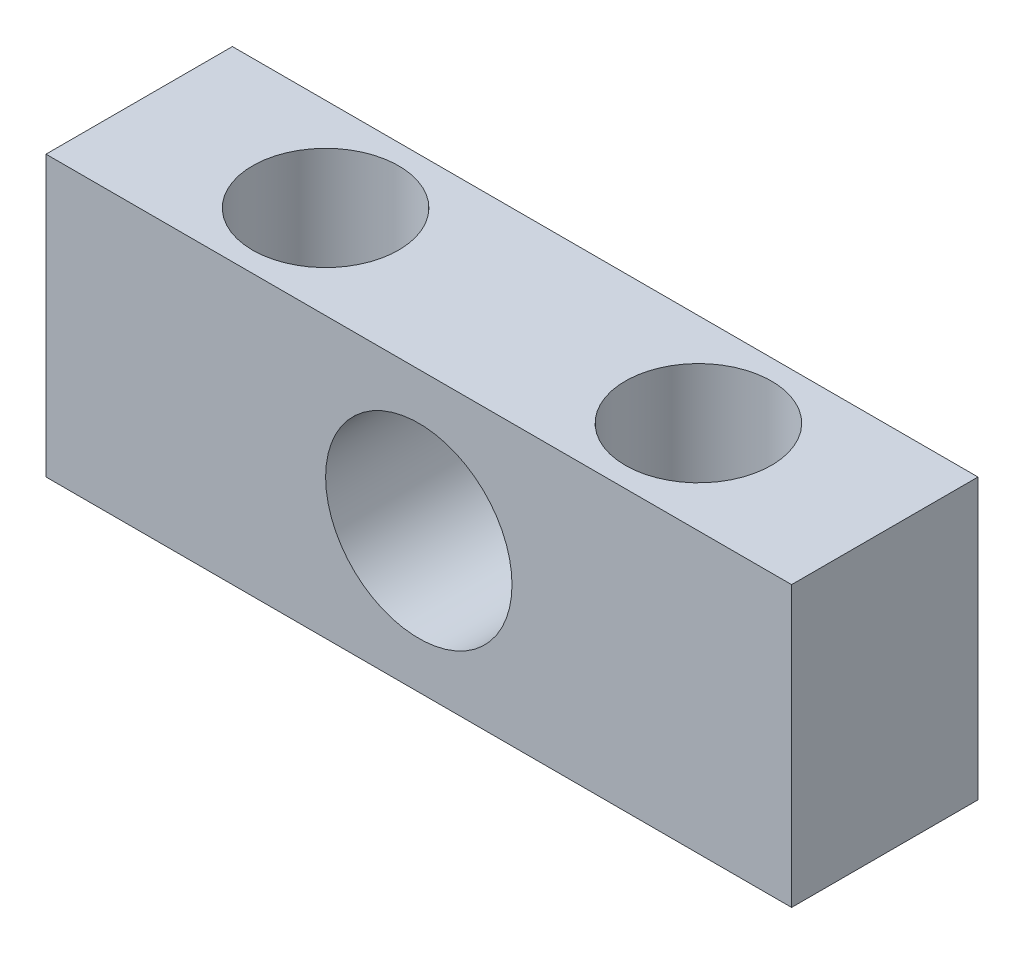
from build123d import *

# Parameters (mm, degrees)
SKETCH1_W               = 25.4
SKETCH1_H               = 9.525
SKETCH1_R               = 3.175
BOSS_EXTRUDE1_DEPTH     = 3.175
CUT_EXTRUDE1_DEPTH      = 14.930255965
CUT_EXTRUDE1_DEPTH_BACK = 14.930255965
SKETCH2_R               = 2.4892


with BuildPart() as part:
    # Sketch1 → Boss-Extrude1 (new, symmetric)
    with BuildSketch(Plane.XY):
        Rectangle(SKETCH1_W, SKETCH1_H)
        Circle(SKETCH1_R, mode=Mode.SUBTRACT)
    extrude(amount=BOSS_EXTRUDE1_DEPTH, both=True)

    # Sketch2 → Cut-Extrude1 (cut, two sides: drawn at the far end of the back side and taken through both)
    with BuildSketch(Plane(origin=(0, 0, 0), x_dir=(1, 0, 0), z_dir=(0, 1, 0)).offset(-CUT_EXTRUDE1_DEPTH_BACK)):
        with Locations(Location((6.35, 0, 0), (0, 0, 270))):
            Circle(SKETCH2_R)
        with Locations(Location((-6.35, 0, 0), (0, 0, 270))):
            Circle(SKETCH2_R)
    extrude(amount=CUT_EXTRUDE1_DEPTH + CUT_EXTRUDE1_DEPTH_BACK, mode=Mode.SUBTRACT)


solid = part.part
